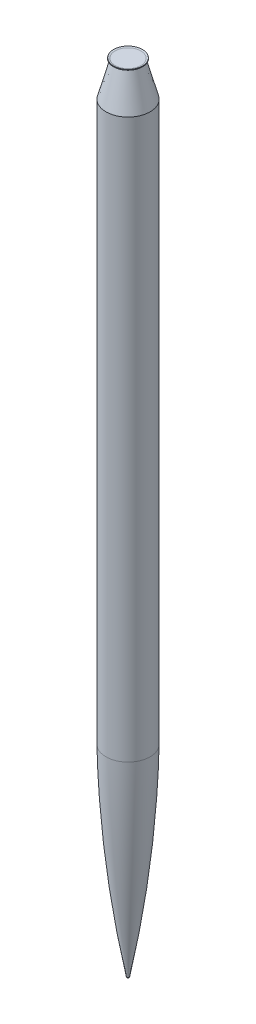
from build123d import *


with BuildPart() as part:
    # Sketch2 → Revolve1 (revolve)
    with BuildSketch(Plane.XY):
        with BuildLine():
            Line((0, 947.42), (0, 6.753760064))
            ThreePointArc((0, 6.753760064), (1.004358981, 7.115605787), (1.547169826, 8.034858568))
            ThreePointArc((1.547169826, 8.034858568), (20.581846727, 138.066176315), (28.575, 269.24))
            Line((28.575, 269.24), (28.575, 947.42))
            Line((28.575, 947.42), (0, 947.42))
        make_face()
    revolve(axis=Axis((0, 0, 0), (0, 1, 0)))

    # Sketch3 → Revolve2 (revolve)
    with BuildSketch(Plane.XY):
        with BuildLine():
            Line((-28.575, 994.156), (-28.575, 947.42))
            Line((-28.575, 947.42), (0, 947.42))
            Line((0, 947.42), (0, 1040.13))
            Line((0, 1040.13), (-16.6116, 1040.13))
            Line((-16.6116, 1040.13), (-18.669, 1040.681278669))
            Line((-18.669, 1040.681278669), (-18.872794116, 1039.920708673))
            Line((-18.872794116, 1039.920708673), (-17.219933754, 1039.477826074))
            ThreePointArc((-17.219933754, 1039.477826074), (-16.757242508, 1039.122790594), (-16.681118386, 1038.544570482))
            Line((-16.681118386, 1038.544570482), (-28.575, 994.156))
        make_face()
    revolve(axis=Axis((0, 1040.13, 0), (0, -1, 0)))


solid = part.part
